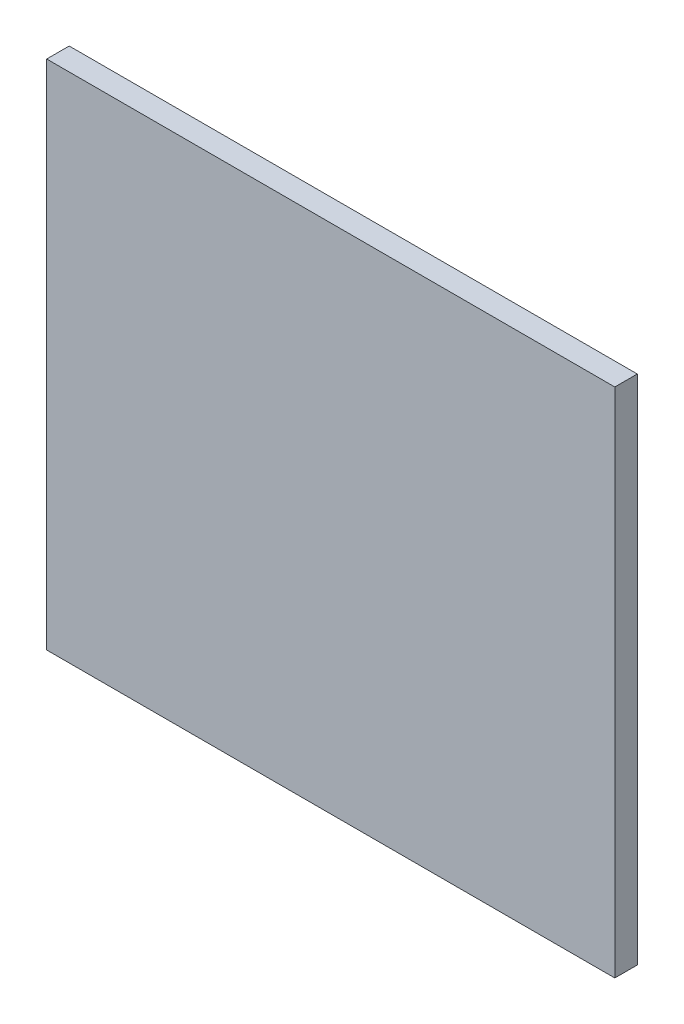
from build123d import *

# Parameters (mm, degrees)
SCHIZZO1_W                   = 50.5
SCHIZZO1_H                   = 45.5
ESTRUSIONE_ESTRUSIONE1_DEPTH = 2


with BuildPart() as part:
    # Schizzo1 → Estrusione-Estrusione1 (new body)
    with BuildSketch(Plane.XY):
        with Locations((25.25, 22.75)):
            Rectangle(SCHIZZO1_W, SCHIZZO1_H)
    extrude(amount=ESTRUSIONE_ESTRUSIONE1_DEPTH)


solid = part.part
